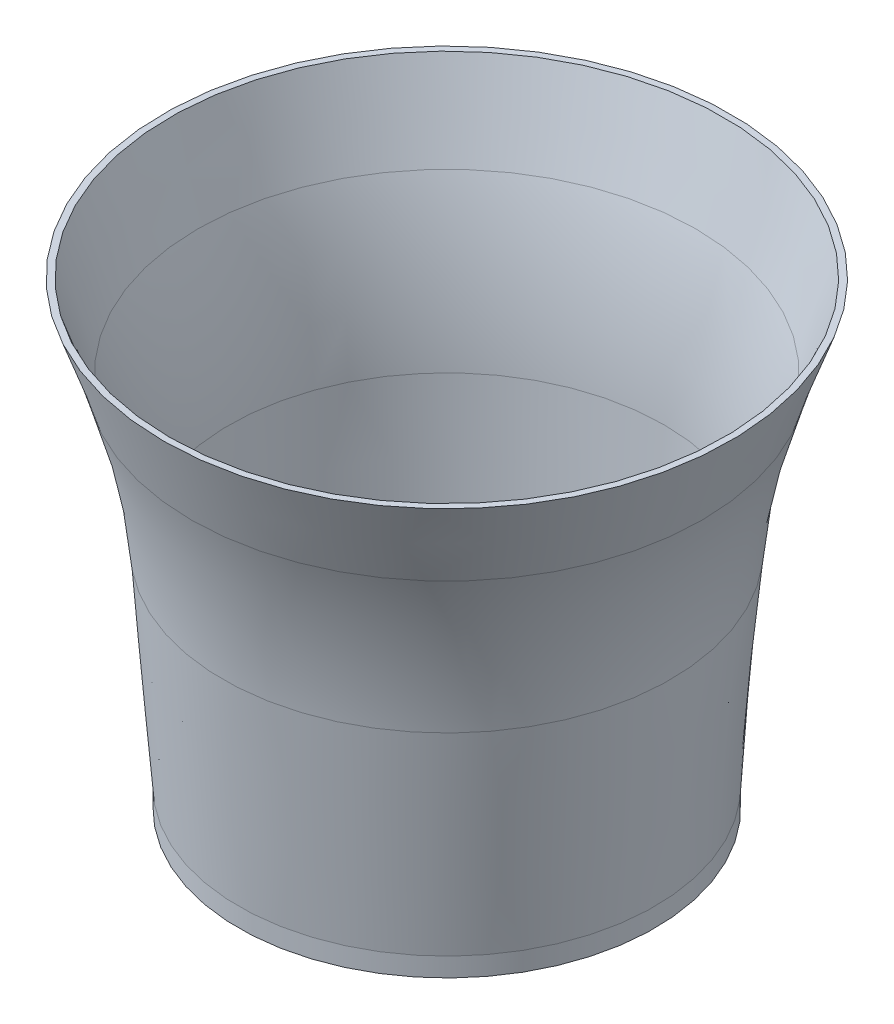
from build123d import *

# Parameters (mm, degrees)
SKETCH4_R               = 33
SKETCH4_R_2             = 2
BOSS_EXTRUDE1_DEPTH     = 3
SKETCH8_R               = 36.5
SKETCH9_R               = 45
SKETCH8_3_R             = 35.5
SKETCH9_3_R             = 44
FILLET1_R               = 100
FILLET2_R               = 100
BOSS_EXTRUDE2_START     = 5
SKETCH10_R              = 27.5
SKETCH10_R_2            = 2
BOSS_EXTRUDE2_DEPTH     = 5
CUT_EXTRUDE1_DEPTH      = 95.604439811
CUT_EXTRUDE1_DEPTH_BACK = 95.604439811
SKETCH11_R              = 2.340885688
SKETCH12_R              = 4
CUT_EXTRUDE2_DEPTH      = 3


with BuildPart() as part:
    # Sketch2 → Revolve1 (revolve)
    with BuildSketch(Plane(origin=(0, 0, 0), x_dir=(0, 0, -1), z_dir=(1, 0, 0)), mode=Mode.PRIVATE) as revolve1_sk:
        Polygon((-32, 0), (-33, 0), (-36.5, 45), (-35.5, 45), align=None)
    revolve(revolve1_sk.sketch.rotate(Axis((0, 0, 0), (0, 1, 0)), 180), axis=Axis((0, 0, 0), (0, 1, 0)))

    # Sketch4 → Boss-Extrude1 (add)
    with BuildSketch(Plane.XZ):
        with Locations(Location((0, 0, 0), (0, 0, 270))):
            Circle(SKETCH4_R)
        with Locations(Location((0, 10, 0), (0, 0, 270))):
            Circle(SKETCH4_R_2, mode=Mode.SUBTRACT)
        with Locations(Location((0, -5, 0), (0, 0, 270))):
            Circle(SKETCH4_R_2, mode=Mode.SUBTRACT)
    extrude(amount=BOSS_EXTRUDE1_DEPTH)

    # Sketch8 → Loft1 section 0
    with BuildSketch(Plane(origin=(0, 45, 0), x_dir=(1, 0, 0), z_dir=(0, 1, 0))):
        Circle(SKETCH8_R)
    # Sketch9 → Loft1 section 1
    with BuildSketch(Plane(origin=(0, 70, 0), x_dir=(1, 0, 0), z_dir=(0, 1, 0))):
        Circle(SKETCH9_R)
    loft()

    # Sketch8<3> → Cut-Loft1 section 0
    with BuildSketch(Plane(origin=(0, 45, 0), x_dir=(1, 0, 0), z_dir=(0, 1, 0))):
        Circle(SKETCH8_3_R)
    # Sketch9<3> → Cut-Loft1 section 1
    with BuildSketch(Plane(origin=(0, 70, 0), x_dir=(1, 0, 0), z_dir=(0, 1, 0))):
        Circle(SKETCH9_3_R)
    loft(mode=Mode.SUBTRACT)

    # Fillet1
    fillet1_edges = [part.edges().sort_by_distance(p)[0] for p in [
        (-25.102290732, 45, 25.102290732),
    ]]
    fillet(fillet1_edges, radius=FILLET1_R)

    # Fillet2
    fillet2_edges = [part.edges().sort_by_distance(p)[0] for p in [
        (-25.809397513, 45, 25.809397513),
    ]]
    fillet(fillet2_edges, radius=FILLET2_R)

    # Sketch10 → Boss-Extrude2 (add)
    with BuildSketch(Plane(origin=(0, 0, 0), x_dir=(1, 0, 0), z_dir=(0, 1, 0)).offset(BOSS_EXTRUDE2_START)):
        with Locations(Location((0, 0, 0), (0, 0, 90))):
            Circle(SKETCH10_R)
        with Locations(Location((0, 5, 0), (0, 0, 90))):
            Circle(SKETCH10_R_2, mode=Mode.SUBTRACT)
        with Locations(Location((0, -10, 0), (0, 0, 90))):
            Circle(SKETCH10_R_2, mode=Mode.SUBTRACT)
    extrude(amount=-BOSS_EXTRUDE2_DEPTH)

    # Sketch11 → Cut-Extrude1 (cut, two sides: drawn at the far end of the back side and taken through both)
    with BuildSketch(Plane(origin=(0, 0, 0), x_dir=(1, 0, 0), z_dir=(0, 1, 0)).offset(-CUT_EXTRUDE1_DEPTH_BACK)):
        with Locations(Location((0, 29.659114312, 0), (0, 0, 270))):
            Circle(SKETCH11_R)
        with Locations(Location((29.659114312, 0, 0), (0, 0, 270))):
            Circle(SKETCH11_R)
        with Locations(Location((0, -29.659114312, 0), (0, 0, 270))):
            Circle(SKETCH11_R)
        with Locations(Location((-29.659114312, 0, 0), (0, 0, 270))):
            Circle(SKETCH11_R)
    extrude(amount=CUT_EXTRUDE1_DEPTH + CUT_EXTRUDE1_DEPTH_BACK, mode=Mode.SUBTRACT)

    # Sketch12 → Cut-Extrude2 (cut)
    with BuildSketch(Plane(origin=(0, 5, 0), x_dir=(1, 0, 0), z_dir=(0, 1, 0))):
        with Locations(Location((0, 5, 0), (0, 0, 270))):
            Circle(SKETCH12_R)
        with Locations(Location((0, -10, 0), (0, 0, 270))):
            Circle(SKETCH12_R)
    extrude(amount=-CUT_EXTRUDE2_DEPTH, mode=Mode.SUBTRACT)


solid = part.part
